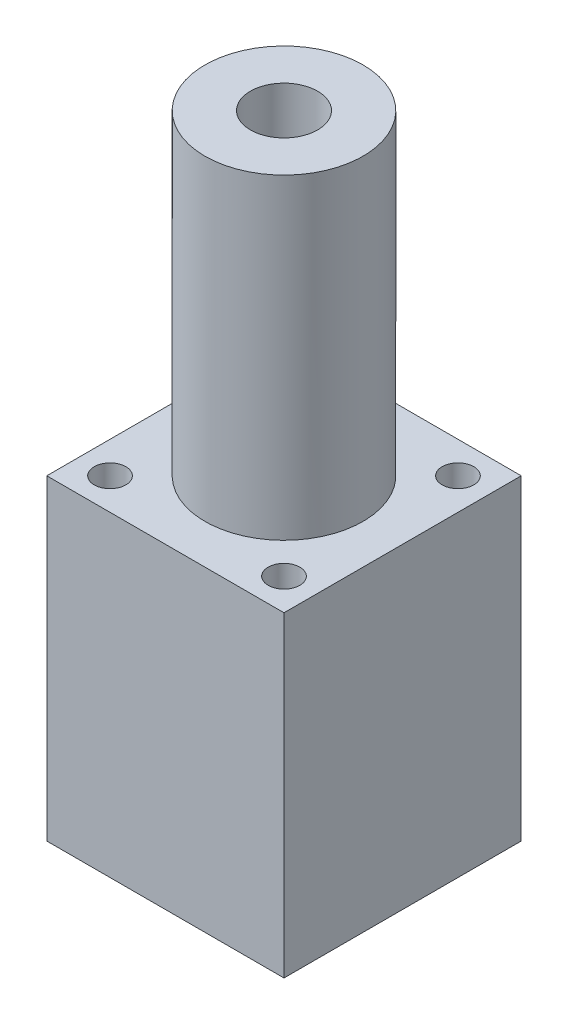
from build123d import *

# Parameters (mm, degrees)
IZIM1_W                     = 30
IZIM1_H                     = 30
Y_KSEKLIK_EKSTR_ZYON1_DEPTH = 40
IZIM2_R                     = 2
KES_EKSTR_ZYON1_DEPTH       = 40
IZIM3_R                     = 10
IZIM3_R_2                   = 4.25
Y_KSEKLIK_EKSTR_ZYON2_DEPTH = 40


with BuildPart() as part:
    # Çizim1 → Yükseklik-Ekstrüzyon1 (new body)
    with BuildSketch(Plane(origin=(0, 0, 0), x_dir=(1, 0, 0), z_dir=(0, 1, 0))):
        with Locations((15, 15)):
            Rectangle(IZIM1_W, IZIM1_H)
    extrude(amount=Y_KSEKLIK_EKSTR_ZYON1_DEPTH)

    # Çizim2 → Kes-Ekstrüzyon1 (cut)
    with BuildSketch(Plane(origin=(0, 40, 0), x_dir=(1, 0, 0), z_dir=(0, 1, 0))):
        with Locations(Location((4, 26, 0), (0, 0, 270))):
            Circle(IZIM2_R)
        with Locations(Location((26, 26, 0), (0, 0, 270))):
            Circle(IZIM2_R)
        with Locations(Location((26, 4, 0), (0, 0, 270))):
            Circle(IZIM2_R)
        with Locations(Location((4, 4, 0), (0, 0, 270))):
            Circle(IZIM2_R)
    extrude(amount=-KES_EKSTR_ZYON1_DEPTH, mode=Mode.SUBTRACT)

    # Çizim3 → Yükseklik-Ekstrüzyon2 (add)
    with BuildSketch(Plane(origin=(0, 40, 0), x_dir=(1, 0, 0), z_dir=(0, 1, 0))):
        with Locations(Location((15, 15, 0), (0, 0, 90))):
            Circle(IZIM3_R)
        with Locations(Location((15, 15, 0), (0, 0, 270))):
            Circle(IZIM3_R_2, mode=Mode.SUBTRACT)
    extrude(amount=Y_KSEKLIK_EKSTR_ZYON2_DEPTH)


solid = part.part
